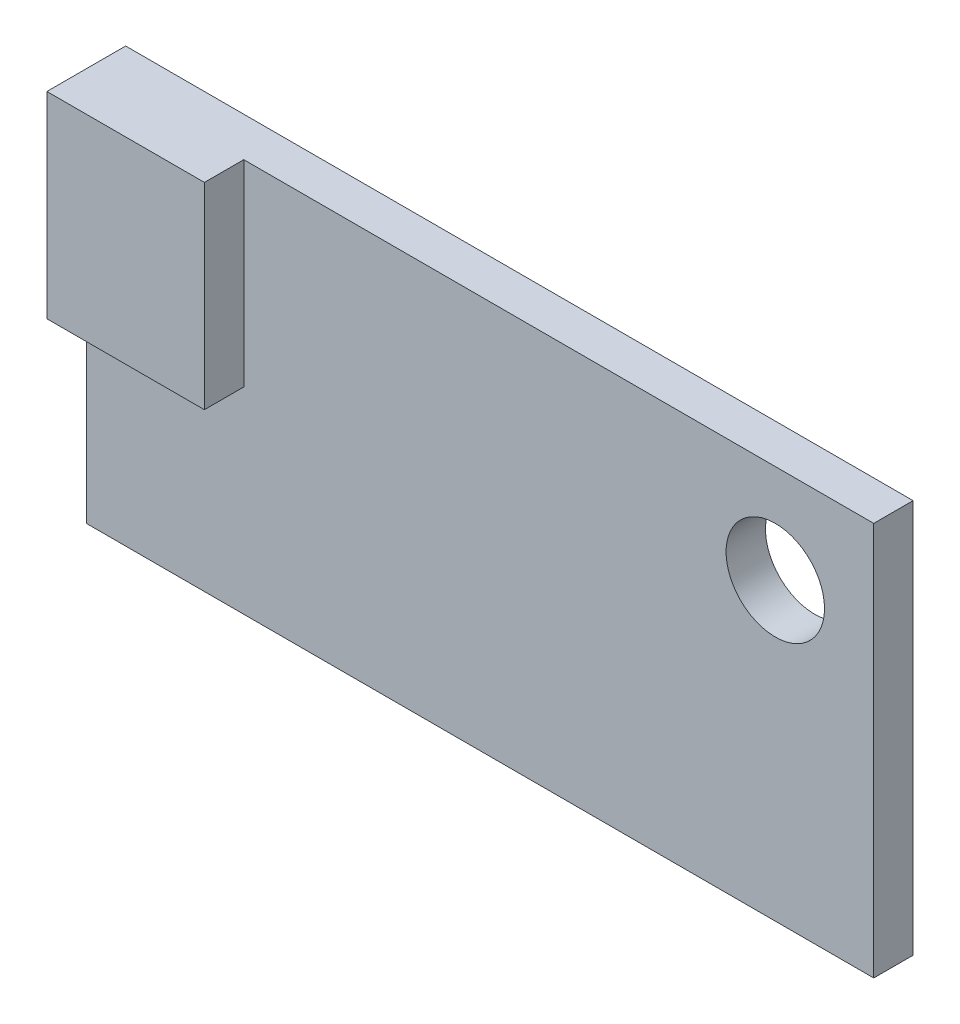
from build123d import *

# Parameters (mm, degrees)
CROQUIS2_W              = 200
CROQUIS2_H              = 100
CROQUIS2_R              = 12.5
SALIENTE_EXTRUIR5_DEPTH = 10
CROQUIS11_W             = 40
CROQUIS11_H             = 50
SALIENTE_EXTRUIR6_DEPTH = 10


with BuildPart() as part:
    # Croquis2 → Saliente-Extruir5 (new body)
    with BuildSketch(Plane.XY):
        with Locations((100, 50)):
            Rectangle(CROQUIS2_W, CROQUIS2_H)
        with Locations((175, 75)):
            Circle(CROQUIS2_R, mode=Mode.SUBTRACT)
    extrude(amount=SALIENTE_EXTRUIR5_DEPTH)

    # Croquis11 → Saliente-Extruir6 (add)
    with BuildSketch(Plane.XY.offset(10)):
        with Locations((20, 75)):
            Rectangle(CROQUIS11_W, CROQUIS11_H)
    extrude(amount=SALIENTE_EXTRUIR6_DEPTH)


solid = part.part
